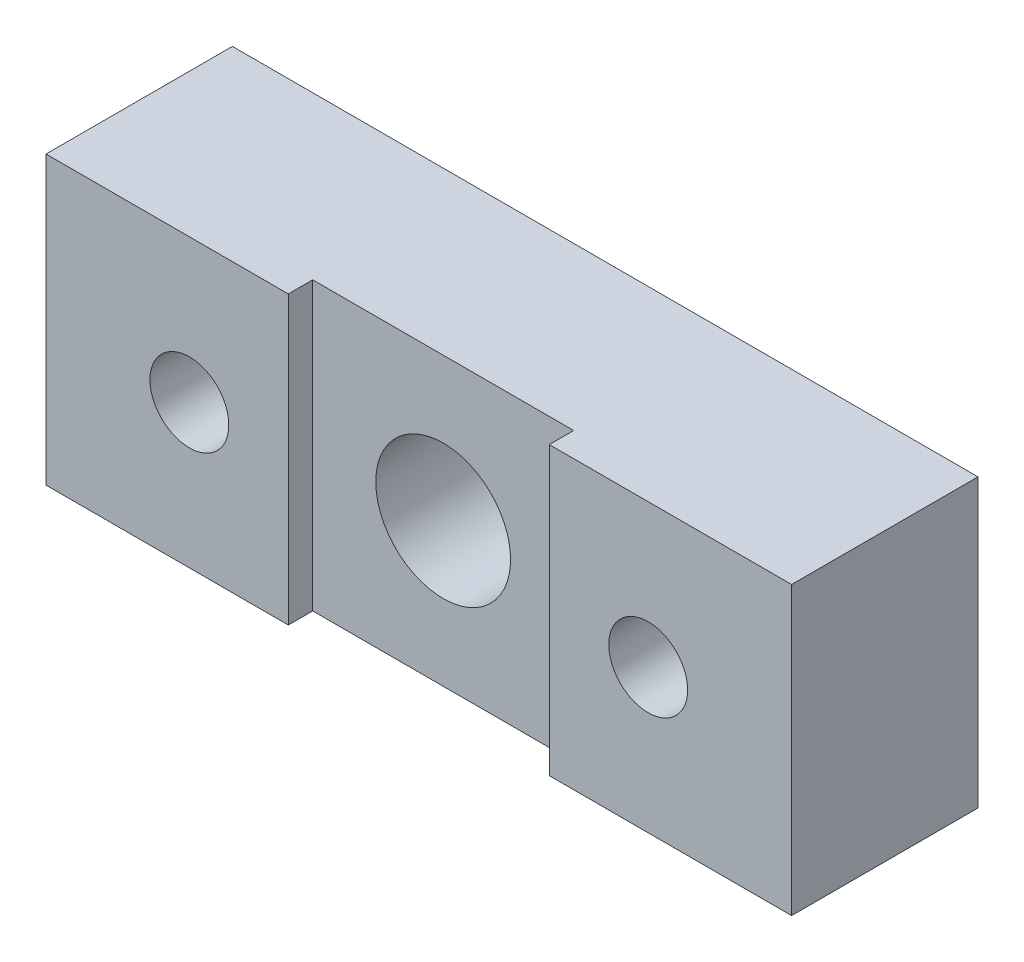
from build123d import *

# Parameters (mm, degrees)
SKETCH_1_W          = 52
SKETCH_1_H          = 20
SKETCH_1_R          = 2.75
SKETCH_1_R_2        = 4.7
EXTRUDE_1_DEPTH     = 13
SKETCH_2_R          = 4.5
CUT_EXTRUDE_1_DEPTH = 5
SKETCH_3_W          = 18.2
SKETCH_3_H          = 20
CUT_EXTRUDE_2_DEPTH = 1.7
FILLET_1_R          = 1


with BuildPart() as part:
    # 草图1 → 凸台-拉伸1 (new body)
    with BuildSketch(Plane.XY):
        Rectangle(SKETCH_1_W, SKETCH_1_H)
        with Locations(Location((-16, 0, 0), (0, 0, 180))):
            Circle(SKETCH_1_R, mode=Mode.SUBTRACT)
        with Locations(Location((16, 0, 0), (0, 0, 180))):
            Circle(SKETCH_1_R, mode=Mode.SUBTRACT)
        with Locations(Location((0, 0, 0), (0, 0, 180))):
            Circle(SKETCH_1_R_2, mode=Mode.SUBTRACT)
    extrude(amount=EXTRUDE_1_DEPTH)

    # 草图2 → 切除-拉伸1 (cut)
    with BuildSketch(Plane(origin=(0, 0, 0), x_dir=(-1, 0, 0), z_dir=(0, 0, -1))):
        with Locations((-16, 0)):
            Circle(SKETCH_2_R)
        with Locations((16, 0)):
            Circle(SKETCH_2_R)
    extrude(amount=-CUT_EXTRUDE_1_DEPTH, mode=Mode.SUBTRACT)

    # 草图3 → 切除-拉伸2 (cut)
    with BuildSketch(Plane.XY.offset(13)):
        Rectangle(SKETCH_3_W, SKETCH_3_H)
    extrude(amount=-CUT_EXTRUDE_2_DEPTH, mode=Mode.SUBTRACT)

    # 圆角1
    fillet_1_edges = [part.edges().sort_by_distance(p)[0] for p in [
        (18.75, 0, 5),
        (-13.25, 0, 5),
    ]]
    fillet(fillet_1_edges, radius=FILLET_1_R)


solid = part.part
